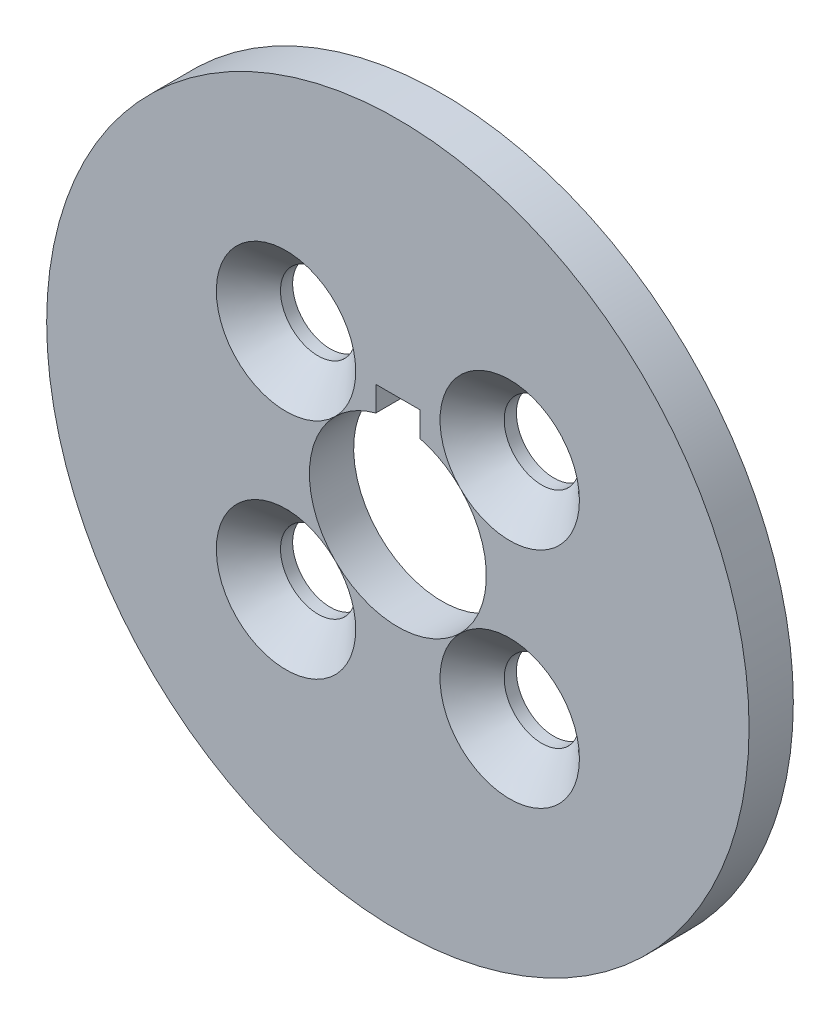
from build123d import *

# Parameters (mm, degrees)
SKETCH1_W                                      = 15.875
SKETCH1_H                                      = 2
CUT_EXTRUDE1_DEPTH                             = 211.522713644
SKETCH3_W                                      = 4
SKETCH3_H                                      = 2
CSK_FOR_M3_FLAT_HEAD_MACHINE_SCREW1_AT_2_COUNT = 2
CSK_FOR_M3_FLAT_HEAD_MACHINE_SCREW1_AT_2_PITCH = 10.111626971
CSK_FOR_M3_FLAT_HEAD_MACHINE_SCREW1_AT_3_COUNT = 2
CSK_FOR_M3_FLAT_HEAD_MACHINE_SCREW1_AT_3_PITCH = 14.3
CSK_FOR_M3_FLAT_HEAD_MACHINE_SCREW1_AT_4_COUNT = 2
CSK_FOR_M3_FLAT_HEAD_MACHINE_SCREW1_AT_4_PITCH = 10.111626971


with BuildPart() as part:
    # Sketch1 → Revolve1 (revolve)
    with BuildSketch(Plane.XZ.offset(-98.885631483), mode=Mode.PRIVATE) as revolve1_sk:
        with Locations((-152.669256626, 1)):
            Rectangle(SKETCH1_W, SKETCH1_H)
    revolve(revolve1_sk.sketch.rotate(Axis((-160.606756626, 98.885631483, 2), (0, 0, -1)), 180), axis=Axis((-160.606756626, 98.885631483, 2), (0, 0, -1)))

    # Sketch2 → Cut-Extrude1 (cut, through all)
    with BuildSketch(Plane(origin=(0, 0, 0), x_dir=(-1, 0, 0), z_dir=(0, 0, -1))):
        with BuildLine():
            Line((161.606756626, 103.885631483), (159.606756626, 103.885631483))
            Line((159.606756626, 103.885631483), (159.606756626, 102.758614829))
            ThreePointArc((159.606756626, 102.758614829), (160.606756626, 102.885631483), (161.606756626, 102.758614829))
            Line((161.606756626, 102.758614829), (161.606756626, 103.885631483))
        make_face()
    extrude(amount=-CUT_EXTRUDE1_DEPTH, mode=Mode.SUBTRACT)

    # Sketch3 → Cut-Revolve1 (revolve, cut)
    with BuildSketch(Plane(origin=(0, 98.885631483, 0), x_dir=(1, 0, 0), z_dir=(0, 1, 0))):
        with Locations((-158.606756626, -1)):
            Rectangle(SKETCH3_W, SKETCH3_H)
    revolve(axis=Axis((-160.606756626, 98.885631483, 0), (0, 0, 1)), mode=Mode.SUBTRACT)

    # Sketch4 → CSK for M3 Flat Head Machine Screw1 (revolve, cut)
    with BuildSketch(Plane(origin=(-165.662570112, 103.941444968, 2), x_dir=(0, -1, 0), z_dir=(1, 0, 0))):
        Polygon((0, 0), (0, 2), (1.7, 2), (1.7, 1.45), (3.15, 0), align=None)
    csk_for_m3_flat_head_machine_screw1 = revolve(axis=Axis((-165.662570112, 103.941444968, 8.35), (0, 0, -1)), mode=Mode.SUBTRACT)

    # CSK for M3 Flat Head Machine Screw1 at 2: CSK for M3 Flat Head Machine Screw1 ×2
    with Locations(*[(i * CSK_FOR_M3_FLAT_HEAD_MACHINE_SCREW1_AT_2_PITCH, 0, 0) for i in range(1, CSK_FOR_M3_FLAT_HEAD_MACHINE_SCREW1_AT_2_COUNT)]):
        add(csk_for_m3_flat_head_machine_screw1, mode=Mode.SUBTRACT)

    # CSK for M3 Flat Head Machine Screw1 at 3: CSK for M3 Flat Head Machine Screw1 ×2
    with Locations(*[Vector(0.7071067811865684, -0.7071067811865267, 0) * (i * CSK_FOR_M3_FLAT_HEAD_MACHINE_SCREW1_AT_3_PITCH) for i in range(1, CSK_FOR_M3_FLAT_HEAD_MACHINE_SCREW1_AT_3_COUNT)]):
        add(csk_for_m3_flat_head_machine_screw1, mode=Mode.SUBTRACT)

    # CSK for M3 Flat Head Machine Screw1 at 4: CSK for M3 Flat Head Machine Screw1 ×2
    with Locations(*[(0, -i * CSK_FOR_M3_FLAT_HEAD_MACHINE_SCREW1_AT_4_PITCH, 0) for i in range(1, CSK_FOR_M3_FLAT_HEAD_MACHINE_SCREW1_AT_4_COUNT)]):
        add(csk_for_m3_flat_head_machine_screw1, mode=Mode.SUBTRACT)


solid = part.part
